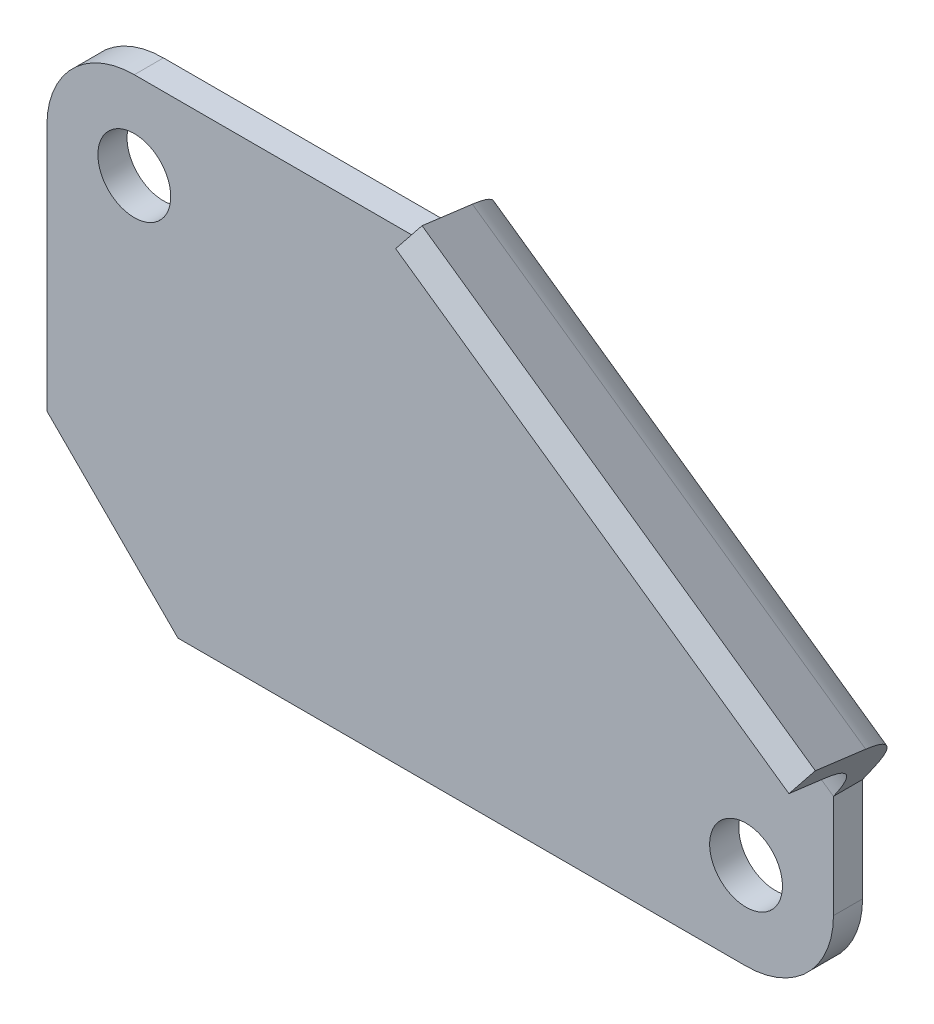
from build123d import *

# Parameters (mm, degrees)
SKETCH1_R           = 5
BOSS_EXTRUDE1_DEPTH = 4
BOSS_EXTRUDE2_START = -65.921828
BOSS_EXTRUDE2_DEPTH = 65.921828
FILLET1_R           = 12


with BuildPart() as part:
    # Sketch1 → Boss-Extrude1 (new body)
    with BuildSketch(Plane.XY):
        with BuildLine():
            Line((0, 0), (0, 34))
            ThreePointArc((0, 34), (3.514718626, 42.485281374), (12, 46))
            Line((12, 46), (54, 46))
            Line((54, 46), (108, 8.188792937))
            Line((108, 8.188792937), (108, -6))
            ThreePointArc((108, -6), (104.485281374, -14.485281374), (96, -18))
            Line((96, -18), (18, -18))
            Line((18, -18), (0, 0))
        make_face()
        with Locations((12, 34)):
            Circle(SKETCH1_R, mode=Mode.SUBTRACT)
        with Locations((96, -6)):
            Circle(SKETCH1_R, mode=Mode.SUBTRACT)
    extrude(amount=BOSS_EXTRUDE1_DEPTH)

    # Sketch5 → Boss-Extrude2 (add)
    with BuildSketch(Plane(origin=(68.621613592, -48.049371121, 0), x_dir=(0, 0, -1), z_dir=(0.819152044288997, -0.5735764363510386, 0)).offset(BOSS_EXTRUDE2_START)):
        with BuildLine():
            Line((-4, 68.6541216), (0, 68.6541216))
            Line((0, 68.6541216), (0, 79.44625787))
            Line((0, 79.44625787), (-16.501573626, 86.113326382))
            Line((-16.501573626, 86.113326382), (-18, 82.404590964))
            Line((-18, 82.404590964), (-11.504720879, 79.780327855))
            ThreePointArc((-11.504720879, 79.780327855), (-6.051549129, 75.364436442), (-4, 68.6541216))
        make_face()
    extrude(amount=BOSS_EXTRUDE2_DEPTH)

    # Fillet1
    fillet1_edges = [part.edges().sort_by_distance(p)[0] for p in [
        (87.190114977, 35.934797015, 0),
    ]]
    fillet(fillet1_edges, radius=FILLET1_R)


solid = part.part
